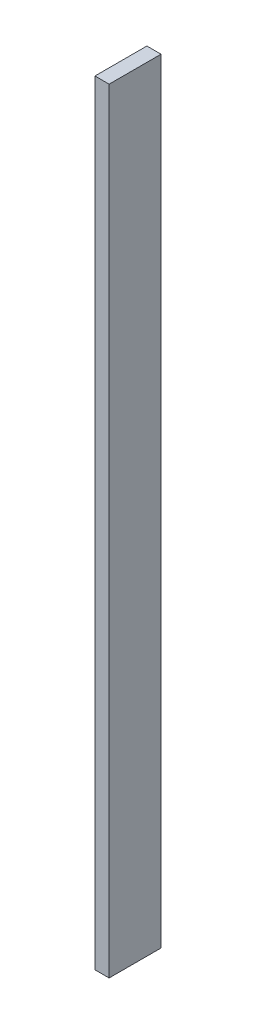
from build123d import *

# Parameters (mm, degrees)
SKETCH1_W           = 38.1
SKETCH1_H           = 139.7
BOSS_EXTRUDE1_DEPTH = 2082.8


with BuildPart() as part:
    # Sketch1 → Boss-Extrude1 (new body)
    with BuildSketch(Plane(origin=(0, 0, 0), x_dir=(1, 0, 0), z_dir=(0, 1, 0))):
        Rectangle(SKETCH1_W, SKETCH1_H)
    extrude(amount=BOSS_EXTRUDE1_DEPTH)


solid = part.part
